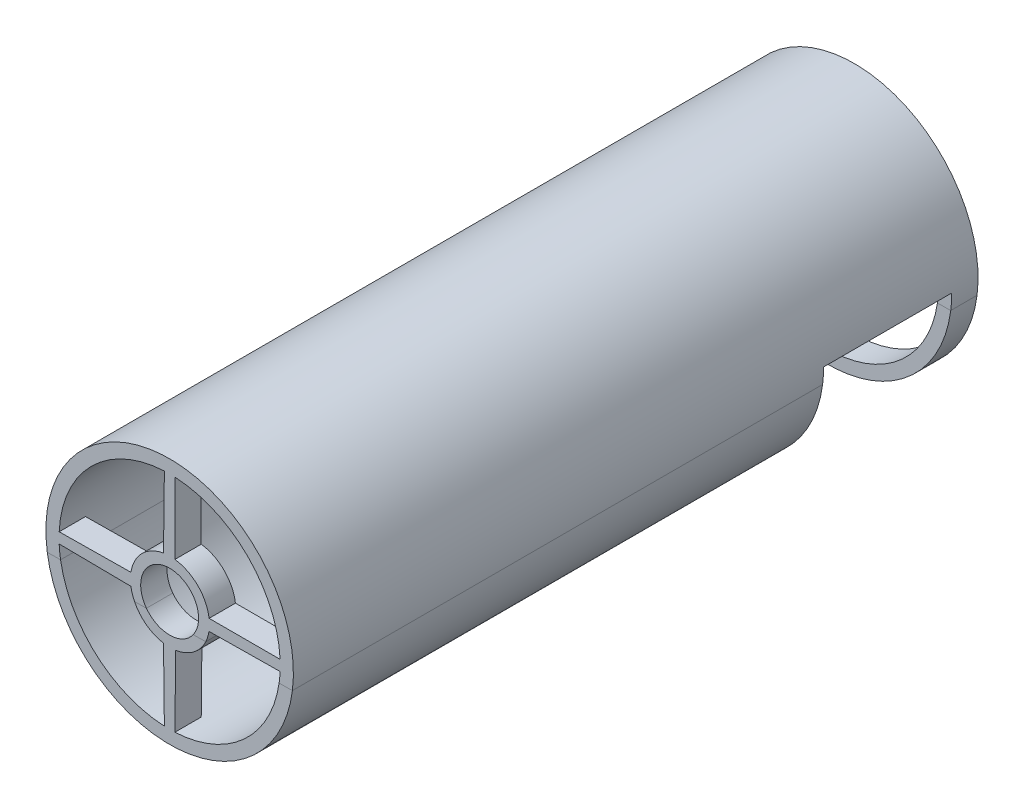
from build123d import *
from build123d.topology import SkipClean

# Parameters (mm, degrees)
SKETCH1_R           = 29.845
SKETCH1_R_2         = 26.67
BOSS_EXTRUDE1_DEPTH = 165.1
SKETCH2_W           = 59.69
SKETCH2_H           = 38.1
CUT_EXTRUDE1_DEPTH  = 171.409677102
BOSS_EXTRUDE2_DEPTH = 6.35
SKETCH5_R           = 6.985
BOSS_EXTRUDE4_DEPTH = 6.35
BOSS_EXTRUDE5_START = -6.35
SKETCH4_R           = 29.845
SKETCH4_R_2         = 26.67
SKETCH4_R_3         = 6.985
BOSS_EXTRUDE5_DEPTH = 6.35


with BuildPart() as part:
    # Sketch1 → Boss-Extrude1 (new body)
    with BuildSketch(Plane.XY):
        Circle(SKETCH1_R)
        Circle(SKETCH1_R_2, mode=Mode.SUBTRACT)
    extrude(amount=BOSS_EXTRUDE1_DEPTH)

    # Sketch2 → Cut-Extrude1 (cut, through all)
    with BuildSketch(Plane(origin=(0, 0, 0), x_dir=(1, 0, 0), z_dir=(0, 1, 0))):
        with Locations((0, -18.194460122)):
            Rectangle(SKETCH2_W, SKETCH2_H)
    extrude(amount=-CUT_EXTRUDE1_DEPTH, mode=Mode.SUBTRACT)

    # Sketch3 → Boss-Extrude2 (add)
    with BuildSketch(Plane(origin=(0, 0, 0), x_dir=(-1, 0, 0), z_dir=(0, 0, -1))):
        with BuildLine():
            Line((-29.845, 0), (-13.97, 0))
            ThreePointArc((-13.97, 0), (0, 13.97), (13.97, 0))
            Line((13.97, 0), (29.845, 0))
            ThreePointArc((29.845, 0), (0, 29.845), (-29.845, 0))
        make_face()
    extrude(amount=-BOSS_EXTRUDE2_DEPTH)

    # Sketch5 → Boss-Extrude4 (add)
    # profile 1 of 2: a face of its own
    with SkipClean():  # the faces are left unmerged after this step: merging them gives an invalid solid
        with BuildSketch(Plane(origin=(0, 0, 0), x_dir=(-1, 0, 0), z_dir=(0, 0, -1))):
            with BuildLine():
                Line((26.639744744, 1.27), (13.898270164, 1.413855169))
                ThreePointArc((13.898270164, 1.413855169), (13.952056017, 0.707836776), (13.97, 0))
                Line((13.97, 0), (29.845, 0))
                ThreePointArc((29.845, 0), (0.635143844, 29.838240855), (-29.81796648, 1.27))
                ThreePointArc((-29.81796648, 1.27), (-29.838240855, 0.635143844), (-29.845, 0))
                Line((-29.845, 0), (-13.97, 0))
                ThreePointArc((-13.97, 0), (-13.955530747, 0.635658375), (-13.912152961, 1.27))
                Line((-13.912152961, 1.27), (-26.639744744, 1.27))
                ThreePointArc((-26.639744744, 1.27), (-18.858537854, 18.858537854), (-1.27, 26.639744744))
                Line((-1.27, 26.639744744), (-1.27, 13.912152961))
                ThreePointArc((-1.27, 13.912152961), (0.07695289, 13.969788053), (1.423189091, 13.897317468))
                Line((1.423189091, 13.897317468), (1.27, 26.639744744))
                ThreePointArc((1.27, 26.639744744), (18.858537854, 18.858537854), (26.639744744, 1.27))
            make_face()
        # profile 2 of 2: a face of its own
        with BuildSketch(Plane(origin=(0, 0, 0), x_dir=(-1, 0, 0), z_dir=(0, 0, -1))):
            with BuildLine():
                Line((13.898270164, 1.413855169), (9.33422749, 1.465384615))
                ThreePointArc((9.33422749, 1.465384615), (6.689709997, 6.703146826), (1.477288556, 9.397267918))
                Line((1.477288556, 9.397267918), (1.423189091, 13.897317468))
                ThreePointArc((1.423189091, 13.897317468), (0.07695289, 13.969788053), (-1.27, 13.912152961))
                Line((-1.27, 13.912152961), (-1.27, 9.45004085))
                ThreePointArc((-1.27, 9.45004085), (-6.784923303, 6.762723487), (-9.517329266, 1.27))
                Line((-9.517329266, 1.27), (-13.912152961, 1.27))
                ThreePointArc((-13.912152961, 1.27), (-13.955530747, 0.635658375), (-13.97, 0))
                Line((-13.97, 0), (-29.845, 0))
                ThreePointArc((-29.845, 0), (0, -29.845), (29.845, 0))
                Line((29.845, 0), (13.97, 0))
                ThreePointArc((13.97, 0), (13.952056017, 0.707836776), (13.898270164, 1.413855169))
            make_face()
            with BuildLine():
                Line((-26.639744744, -1.27), (-9.488978712, -1.465384615))
                ThreePointArc((-9.488978712, -1.465384615), (-6.780569847, -6.767038646), (-1.453480675, -9.425070814))
                Line((-1.453480675, -9.425070814), (-1.27, -26.639744744))
                ThreePointArc((-1.27, -26.639744744), (-18.858537854, -18.858537854), (-26.639744744, -1.27))
            make_face(mode=Mode.SUBTRACT)
            with BuildLine():
                Line((9.33422749, -1.465384615), (26.639744744, -1.27))
                ThreePointArc((26.639744744, -1.27), (18.858537854, -18.858537854), (1.27, -26.639744744))
                Line((1.27, -26.639744744), (1.477288556, -9.397267918))
                ThreePointArc((1.477288556, -9.397267918), (6.689709997, -6.703146826), (9.33422749, -1.465384615))
            make_face(mode=Mode.SUBTRACT)
            Circle(SKETCH5_R, mode=Mode.SUBTRACT)
        extrude(amount=-BOSS_EXTRUDE4_DEPTH)

    # Sketch4 → Boss-Extrude5 (add)
    # profile 1 of 2: a face of its own
    with SkipClean():  # the faces are left unmerged after this step: merging them gives an invalid solid
        with BuildSketch(Plane.XY.offset(165.1).offset(BOSS_EXTRUDE5_START)):
            Circle(SKETCH4_R)
            with Locations(Location((0, 0, 0), (0, 0, 180))):
                Circle(SKETCH4_R_2, mode=Mode.SUBTRACT)
        # profile 2 of 2: a face of its own
        with BuildSketch(Plane.XY.offset(165.1).offset(BOSS_EXTRUDE5_START)):
            with BuildLine():
                Line((1.27, 9.45004085), (1.27, 26.639744744))
                ThreePointArc((1.27, 26.639744744), (0, 26.67), (-1.27, 26.639744744))
                Line((-1.27, 26.639744744), (-1.477288556, 9.397267918))
                ThreePointArc((-1.477288556, 9.397267918), (-6.689709997, 6.703146826), (-9.33422749, 1.465384615))
                Line((-9.33422749, 1.465384615), (-26.639744744, 1.27))
                ThreePointArc((-26.639744744, 1.27), (-26.67, 0), (-26.639744744, -1.27))
                Line((-26.639744744, -1.27), (-9.33422749, -1.465384615))
                ThreePointArc((-9.33422749, -1.465384615), (-6.689709997, -6.703146826), (-1.477288556, -9.397267918))
                Line((-1.477288556, -9.397267918), (-1.27, -26.639744744))
                ThreePointArc((-1.27, -26.639744744), (0, -26.67), (1.27, -26.639744744))
                Line((1.27, -26.639744744), (1.453480675, -9.425070814))
                ThreePointArc((1.453480675, -9.425070814), (6.780569847, -6.767038646), (9.488978712, -1.465384615))
                Line((9.488978712, -1.465384615), (26.639744744, -1.27))
                ThreePointArc((26.639744744, -1.27), (26.662435113, -0.635180167), (26.67, 0))
                ThreePointArc((26.67, 0), (26.662435113, 0.635180167), (26.639744744, 1.27))
                Line((26.639744744, 1.27), (9.517329266, 1.27))
                ThreePointArc((9.517329266, 1.27), (6.784923303, 6.762723487), (1.27, 9.45004085))
            make_face()
            with Locations(Location((0, 0, 0), (0, 0, 180))):
                Circle(SKETCH4_R_3, mode=Mode.SUBTRACT)
        extrude(amount=BOSS_EXTRUDE5_DEPTH)


with BuildPart() as body_2:
    # Split4: the piece on the far side of the plane
    add(part.part)
    split(bisect_by=Plane(origin=(0.046857356, -4.11311578, 0), x_dir=(0.9999351154319066, 0.011391440917629184, 0), z_dir=(-0.011391440917629184, 0.9999351154319066, 0)), keep=Keep.BOTTOM)


with BuildPart() as part_1:
    add(part.part)

    # Split4
    split(bisect_by=Plane(origin=(0.046857356, -4.11311578, 0), x_dir=(0.9999351154319066, 0.011391440917629184, 0), z_dir=(-0.011391440917629184, 0.9999351154319066, 0)), keep=Keep.TOP)


solid = Compound([body_2.part, part_1.part])
